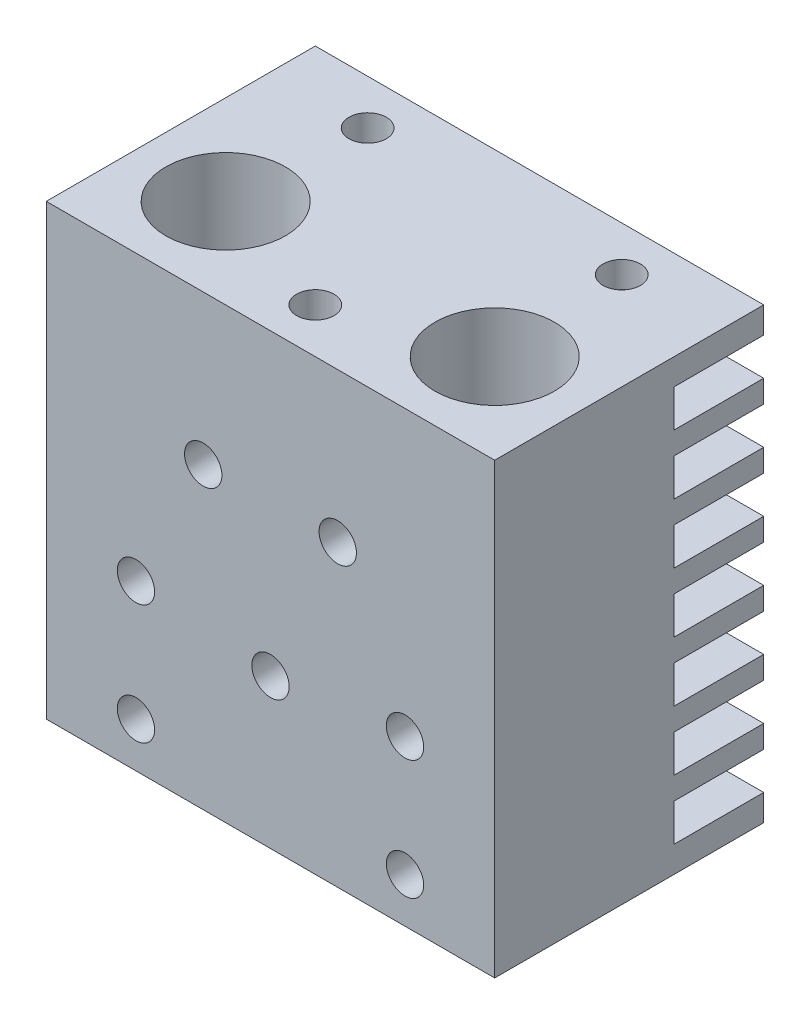
from build123d import *
from OCP.BRepFilletAPI import BRepFilletAPI_MakeChamfer

# Parameters (mm, degrees)
SKETCH1_W           = 30
SKETCH1_H           = 18
BOSS_EXTRUDE1_DEPTH = 30
SKETCH2_R           = 1.25
CUT_EXTRUDE1_DEPTH  = 8
SKETCH3_R           = 4
CUT_EXTRUDE2_DEPTH  = 6.5
SKETCH4_R           = 2.1
CUT_EXTRUDE3_DEPTH  = 30.295904151
CUT_EXTRUDE4_REACH  = 45.37
SKETCH5_W           = 12
SKETCH5_H           = 2.5
SKETCH6_R           = 3.45
CUT_EXTRUDE5_DEPTH  = 14
SKETCH7_R           = 1.25
CUT_EXTRUDE6_DEPTH  = 39.065732621
CHAMFER1_SIZE       = 1.7
CHAMFER1_SIZE2      = 0.65256886


with BuildPart() as part:
    # Sketch1 → Boss-Extrude1 (new body)
    with BuildSketch(Plane(origin=(0, 0, 0), x_dir=(1, 0, 0), z_dir=(0, 1, 0))):
        Rectangle(SKETCH1_W, SKETCH1_H)
    extrude(amount=BOSS_EXTRUDE1_DEPTH)

    # Sketch2 → Cut-Extrude1 (cut)
    with BuildSketch(Plane(origin=(0, 30, 0), x_dir=(1, 0, 0), z_dir=(0, 1, 0))):
        with Locations(Location((0, -6, 0), (0, 0, 270))):
            Circle(SKETCH2_R)
        with Locations(Location((-8.5, 6, 0), (0, 0, 270))):
            Circle(SKETCH2_R)
        with Locations(Location((8.5, 6, 0), (0, 0, 270))):
            Circle(SKETCH2_R)
    extrude(amount=-CUT_EXTRUDE1_DEPTH, mode=Mode.SUBTRACT)

    # Sketch3 → Cut-Extrude2 (cut)
    with BuildSketch(Plane(origin=(0, 30, 0), x_dir=(1, 0, 0), z_dir=(0, 1, 0))):
        with Locations(Location((-9, -3, 0), (0, 0, 270))):
            Circle(SKETCH3_R)
        with Locations(Location((9, -3, 0), (0, 0, 270))):
            Circle(SKETCH3_R)
    extrude(amount=-CUT_EXTRUDE2_DEPTH, mode=Mode.SUBTRACT)

    # Sketch4 → Cut-Extrude3 (cut, through all)
    with BuildSketch(Plane(origin=(0, 23.5, 0), x_dir=(1, 0, 0), z_dir=(0, 1, 0))):
        with Locations(Location((9, -3, 0), (0, 0, 270))):
            Circle(SKETCH4_R)
        with Locations(Location((-9, -3, 0), (0, 0, 270))):
            Circle(SKETCH4_R)
    extrude(amount=-CUT_EXTRUDE3_DEPTH, mode=Mode.SUBTRACT)

    # Sketch5 → Cut-Extrude4 (cut, up to next)
    with BuildSketch(Plane(origin=(15, 0, 0), x_dir=(0, 0, -1), z_dir=(1, 0, 0)), mode=Mode.PRIVATE) as cut_extrude4_sk1:
        with Locations((9, 7)):
            Rectangle(SKETCH5_W, SKETCH5_H)
    cut_extrude4_tool1 = extrude(cut_extrude4_sk1.sketch, amount=-CUT_EXTRUDE4_REACH, mode=Mode.PRIVATE) & part.part
    # Sketch5 → Cut-Extrude4 (cut, up to next)
    with BuildSketch(Plane(origin=(15, 0, 0), x_dir=(0, 0, -1), z_dir=(1, 0, 0)), mode=Mode.PRIVATE) as cut_extrude4_sk2:
        with Locations((9, 11)):
            Rectangle(SKETCH5_W, SKETCH5_H)
    cut_extrude4_tool2 = extrude(cut_extrude4_sk2.sketch, amount=-CUT_EXTRUDE4_REACH, mode=Mode.PRIVATE) & part.part
    # Sketch5 → Cut-Extrude4 (cut, up to next)
    with BuildSketch(Plane(origin=(15, 0, 0), x_dir=(0, 0, -1), z_dir=(1, 0, 0)), mode=Mode.PRIVATE) as cut_extrude4_sk3:
        with Locations((9, 15)):
            Rectangle(SKETCH5_W, SKETCH5_H)
    cut_extrude4_tool3 = extrude(cut_extrude4_sk3.sketch, amount=-CUT_EXTRUDE4_REACH, mode=Mode.PRIVATE) & part.part
    # Sketch5 → Cut-Extrude4 (cut, up to next)
    with BuildSketch(Plane(origin=(15, 0, 0), x_dir=(0, 0, -1), z_dir=(1, 0, 0)), mode=Mode.PRIVATE) as cut_extrude4_sk4:
        with Locations((9, 19)):
            Rectangle(SKETCH5_W, SKETCH5_H)
    cut_extrude4_tool4 = extrude(cut_extrude4_sk4.sketch, amount=-CUT_EXTRUDE4_REACH, mode=Mode.PRIVATE) & part.part
    # Sketch5 → Cut-Extrude4 (cut, up to next)
    with BuildSketch(Plane(origin=(15, 0, 0), x_dir=(0, 0, -1), z_dir=(1, 0, 0)), mode=Mode.PRIVATE) as cut_extrude4_sk5:
        with Locations((9, 23)):
            Rectangle(SKETCH5_W, SKETCH5_H)
    cut_extrude4_tool5 = extrude(cut_extrude4_sk5.sketch, amount=-CUT_EXTRUDE4_REACH, mode=Mode.PRIVATE) & part.part
    # Sketch5 → Cut-Extrude4 (cut, up to next)
    with BuildSketch(Plane(origin=(15, 0, 0), x_dir=(0, 0, -1), z_dir=(1, 0, 0)), mode=Mode.PRIVATE) as cut_extrude4_sk6:
        with Locations((9, 27)):
            Rectangle(SKETCH5_W, SKETCH5_H)
    cut_extrude4_tool6 = extrude(cut_extrude4_sk6.sketch, amount=-CUT_EXTRUDE4_REACH, mode=Mode.PRIVATE) & part.part
    # Sketch5 → Cut-Extrude4 (cut, up to next)
    with BuildSketch(Plane(origin=(15, 0, 0), x_dir=(0, 0, -1), z_dir=(1, 0, 0)), mode=Mode.PRIVATE) as cut_extrude4_sk7:
        with Locations((9, 3)):
            Rectangle(SKETCH5_W, SKETCH5_H)
    cut_extrude4_tool7 = extrude(cut_extrude4_sk7.sketch, amount=-CUT_EXTRUDE4_REACH, mode=Mode.PRIVATE) & part.part
    add(cut_extrude4_tool1.solids().sort_by_distance((15, 7, -9))[0], mode=Mode.SUBTRACT)
    add(cut_extrude4_tool2.solids().sort_by_distance((15, 11, -9))[0], mode=Mode.SUBTRACT)
    add(cut_extrude4_tool3.solids().sort_by_distance((15, 15, -9))[0], mode=Mode.SUBTRACT)
    add(cut_extrude4_tool4.solids().sort_by_distance((15, 19, -9))[0], mode=Mode.SUBTRACT)
    add(cut_extrude4_tool5.solids().sort_by_distance((15, 23, -9))[0], mode=Mode.SUBTRACT)
    add(cut_extrude4_tool6.solids().sort_by_distance((15, 27, -9))[0], mode=Mode.SUBTRACT)
    add(cut_extrude4_tool7.solids().sort_by_distance((15, 3, -9))[0], mode=Mode.SUBTRACT)

    # Sketch6 → Cut-Extrude5 (cut)
    with BuildSketch(Plane.XZ):
        with Locations(Location((9, 3, 0), (0, 0, 270))):
            Circle(SKETCH6_R)
        with Locations(Location((-9, 3, 0), (0, 0, 270))):
            Circle(SKETCH6_R)
    extrude(amount=-CUT_EXTRUDE5_DEPTH, mode=Mode.SUBTRACT)

    # Sketch7 → Cut-Extrude6 (cut, through all)
    with BuildSketch(Plane.XY.offset(9)):
        with Locations((-4.5, 20)):
            Circle(SKETCH7_R)
        with Locations((4.5, 20)):
            Circle(SKETCH7_R)
        with Locations((-9, 11)):
            Circle(SKETCH7_R)
        with Locations((-9, 3)):
            Circle(SKETCH7_R)
        with Locations((9, 11)):
            Circle(SKETCH7_R)
        with Locations((9, 3)):
            Circle(SKETCH7_R)
        with Locations((0, 10)):
            Circle(SKETCH7_R)
    extrude(amount=-CUT_EXTRUDE6_DEPTH, mode=Mode.SUBTRACT)

    # Chamfer1: one chamfer whose edges measure the first distance from different faces: ONE call of the kernel's chamfer builder (chamfer() names one face for all edges)
    chamfer1_edges_1 = [part.edges().sort_by_distance(p)[0] for p in [
        (9, 23.5, 0.9),
    ]]
    chamfer1_side_1 = [part.faces().sort_by_distance(p)[0] for p in [
        (9, 23.5, -0.886862915),
    ]]
    chamfer1_edges_2 = [part.edges().sort_by_distance(p)[0] for p in [
        (-9, 23.5, 0.9),
    ]]
    chamfer1_side_2 = [part.faces().sort_by_distance(p)[0] for p in [
        (-9, 23.5, -0.886862915),
    ]]
    chamfer1 = BRepFilletAPI_MakeChamfer(part.part.solid().wrapped)
    for e in chamfer1_edges_1:
        chamfer1.Add(CHAMFER1_SIZE, CHAMFER1_SIZE2, e.wrapped, chamfer1_side_1[0].wrapped)  # the first distance lies on this face
    for e in chamfer1_edges_2:
        chamfer1.Add(CHAMFER1_SIZE, CHAMFER1_SIZE2, e.wrapped, chamfer1_side_2[0].wrapped)  # the first distance lies on this face
    add(Compound.cast(chamfer1.Shape()), mode=Mode.REPLACE)


solid = part.part
